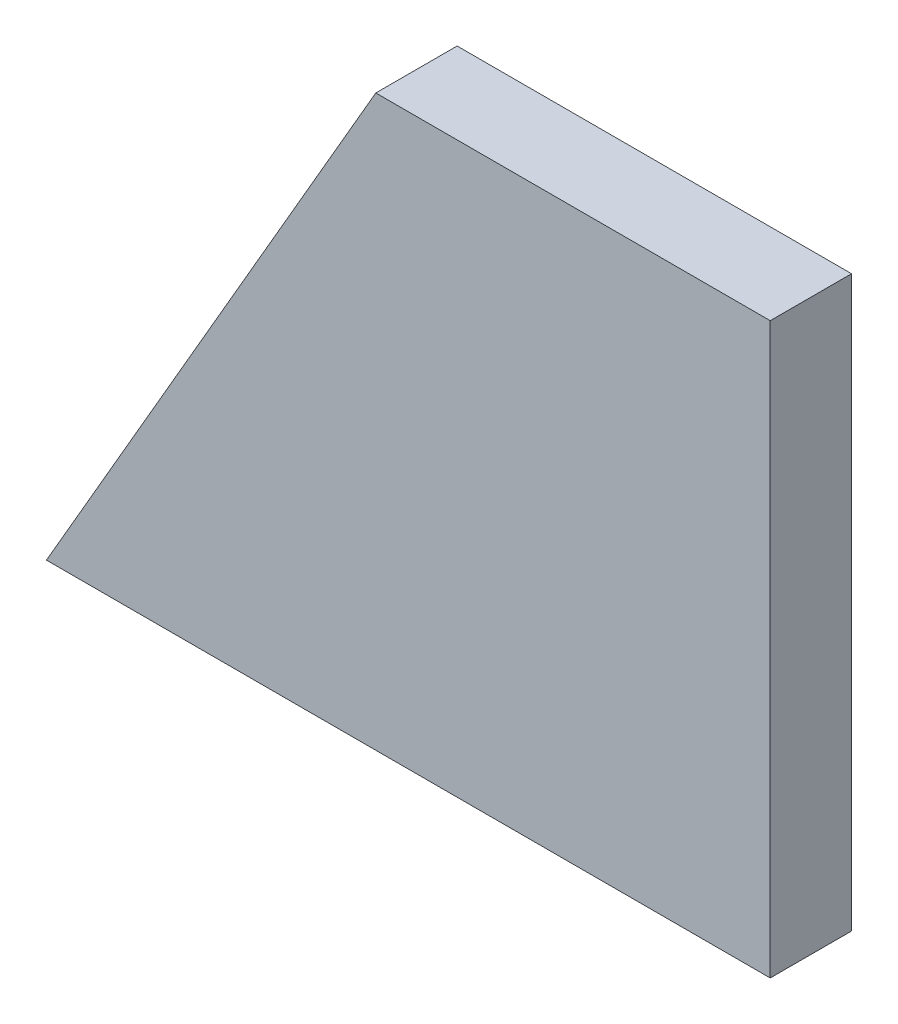
from build123d import *

# Parameters (mm, degrees)
EXTRUDE_1_DEPTH = 10


with BuildPart() as part:
    # Эскиз1 → Бобышка-Вытянуть1 (new body)
    with BuildSketch(Plane.XY):
        Polygon((-48.5, 70), (-89, 0), (0, 0), (0, 70), align=None)
    extrude(amount=EXTRUDE_1_DEPTH)


solid = part.part
